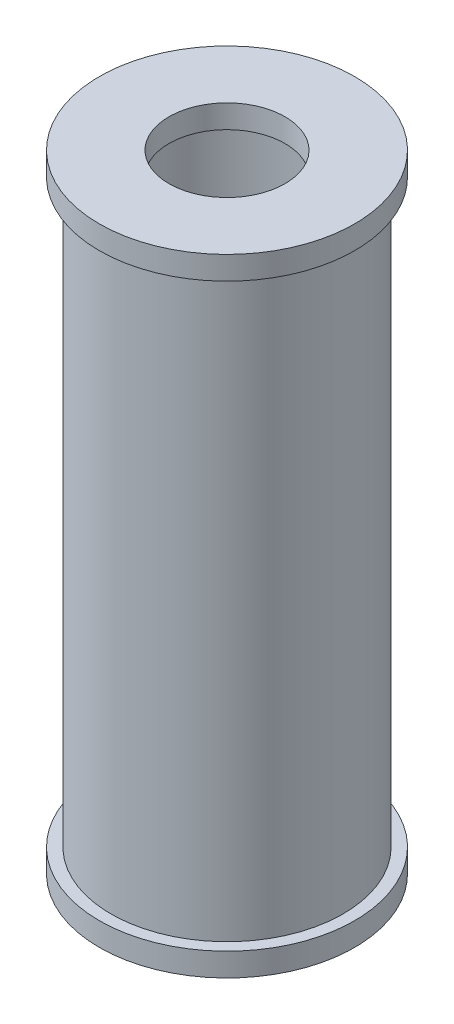
from build123d import *

# Parameters (mm, degrees)
SKETCH1_W           = 2
SKETCH1_H           = 100
SKETCH2_R           = 22
BOSS_EXTRUDE1_DEPTH = 4
BOSS_EXTRUDE2_START = 4
SKETCH3_R           = 22
BOSS_EXTRUDE2_DEPTH = 4
SKETCH4_R           = 10
CUT_EXTRUDE1_DEPTH  = 4


with BuildPart() as part:
    # Sketch1 → Revolve1 (revolve)
    with BuildSketch(Plane.XY, mode=Mode.PRIVATE) as revolve1_sk:
        with Locations((19, 50)):
            Rectangle(SKETCH1_W, SKETCH1_H)
    revolve(revolve1_sk.sketch.rotate(Axis((0, 0, 0), (0, 1, 0)), 90), axis=Axis((0, 0, 0), (0, 1, 0)))

    # Sketch2 → Boss-Extrude1 (add)
    with BuildSketch(Plane(origin=(0, 100, 0), x_dir=(1, 0, 0), z_dir=(0, 1, 0))):
        with Locations(Location((0, 0, 0), (0, 0, 270))):
            Circle(SKETCH2_R)
    extrude(amount=BOSS_EXTRUDE1_DEPTH)

    # Sketch3 → Boss-Extrude2 (add)
    with BuildSketch(Plane.XZ.offset(BOSS_EXTRUDE2_START)):
        with Locations(Location((0, 0, 0), (0, 0, 90))):
            Circle(SKETCH3_R)
    extrude(amount=-BOSS_EXTRUDE2_DEPTH)

    # Sketch4 → Cut-Extrude1 (cut)
    with BuildSketch(Plane(origin=(0, 104, 0), x_dir=(1, 0, 0), z_dir=(0, 1, 0))):
        with Locations(Location((0, 0, 0), (0, 0, 270))):
            Circle(SKETCH4_R)
    extrude(amount=-CUT_EXTRUDE1_DEPTH, mode=Mode.SUBTRACT)


solid = part.part
